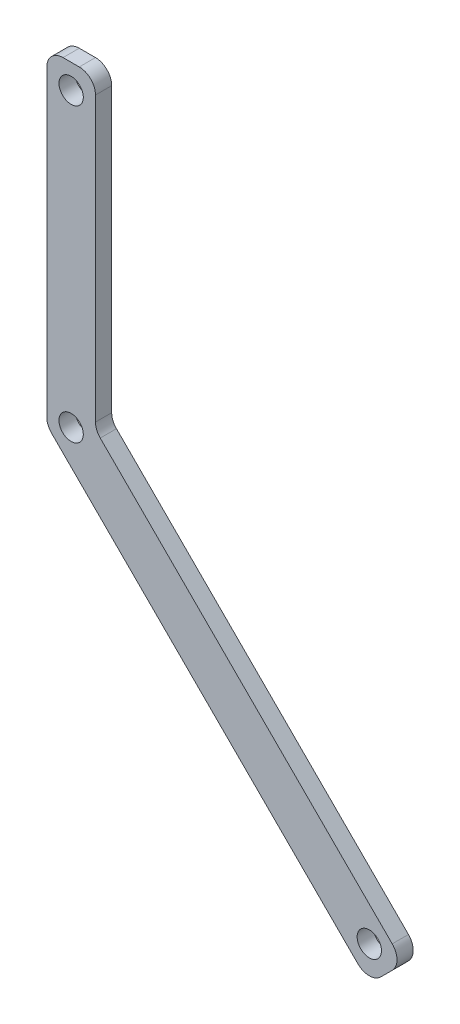
from build123d import *

# Parameters (mm, degrees)
ESQUISSE2_R        = 1.5
BOSS_EXTRU_3_DEPTH = 2
CONG_3_R           = 2


with BuildPart() as part:
    # Esquisse2 → Boss.-Extru.3 (new body)
    with BuildSketch(Plane.XY):
        Polygon((-3, 21), (-3, -19.242640687), (36.769552622, -59.012193309), (41.012193309, -54.769552622), (3, -16.757359313), (3, 21), align=None)
        with Locations((36.769552622, -54.769552622)):
            Circle(ESQUISSE2_R, mode=Mode.SUBTRACT)
        with Locations((0, -18)):
            Circle(ESQUISSE2_R, mode=Mode.SUBTRACT)
        with Locations((0, 18)):
            Circle(ESQUISSE2_R, mode=Mode.SUBTRACT)
    extrude(amount=BOSS_EXTRU_3_DEPTH)

    # Congé3
    cong_3_edges = [part.edges().sort_by_distance(p)[0] for p in [
        (-3, -19.242640687, 1),
        (-3, 21, 1),
        (3, 21, 1),
        (3, -16.757359313, 1),
        (41.012193309, -54.769552622, 1),
        (36.769552622, -59.012193309, 1),
    ]]
    fillet(cong_3_edges, radius=CONG_3_R)


solid = part.part
